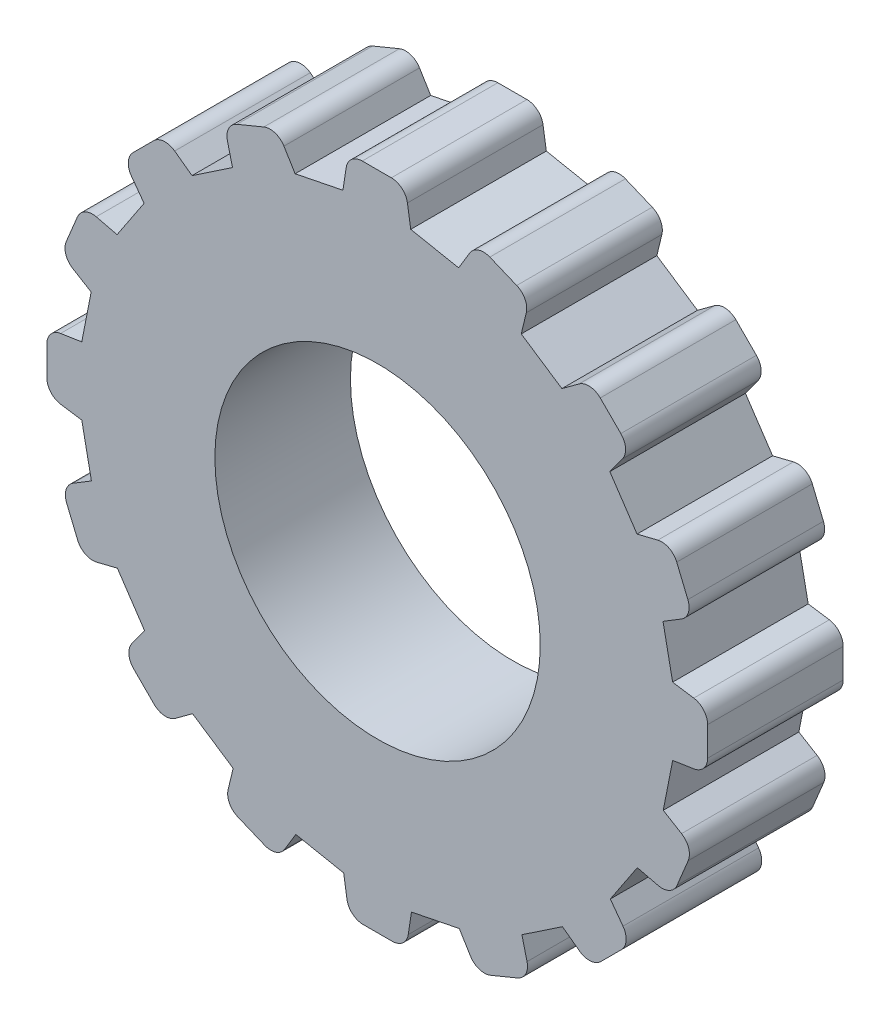
from build123d import *

# Parameters (mm, degrees)
ESQUISSE5_R        = 6
BOSS_EXTRU_1_DEPTH = 5


with BuildPart() as part:
    # Esquisse5 → Boss.-Extru.1 (new body)
    with BuildSketch(Plane.XY):
        with BuildLine():
            Line((0, 12.187189413), (0.508919212, 12.187189413))
            ThreePointArc((0.508919212, 12.187189413), (0.899044051, 12.043043128), (1.101718736, 11.679864778))
            Line((1.101718736, 11.679864778), (1.223875428, 10.898487461))
            Line((1.223875428, 10.898487461), (2.990113971, 10.551498398))
            Line((2.990113971, 10.551498398), (3.397524082, 11.2264814))
            ThreePointArc((3.397524082, 11.2264814), (3.723877023, 11.486437733), (4.140815501, 11.470758379))
            Line((4.140815501, 11.470758379), (4.661933908, 11.254904067))
            Line((4.661933908, 11.254904067), (5.132113951, 11.060149116))
            ThreePointArc((5.132113951, 11.060149116), (5.43737991, 10.777681002), (5.485644567, 10.364587714))
            Line((5.485644567, 10.364587714), (5.29948248, 9.595941861))
            Line((5.29948248, 9.595941861), (6.798487154, 8.59945554))
            Line((6.798487154, 8.59945554), (7.433189829, 9.06714942))
            ThreePointArc((7.433189829, 9.06714942), (7.834181612, 9.182427892), (8.21338231, 9.00838661))
            Line((8.21338231, 9.00838661), (8.612229071, 8.609539849))
            Line((8.612229071, 8.609539849), (8.972089297, 8.249679623))
            ThreePointArc((8.972089297, 8.249679623), (9.146022401, 7.871892888), (9.032529172, 7.47177437))
            Line((9.032529172, 7.47177437), (8.566389797, 6.832879345))
            Line((8.566389797, 6.832879345), (9.569950728, 5.338601775))
            Line((9.569950728, 5.338601775), (10.335318239, 5.52780438))
            ThreePointArc((10.335318239, 5.52780438), (10.749901501, 5.480854889), (11.033634549, 5.174947886))
            Line((11.033634549, 5.174947886), (11.249488861, 4.653829479))
            Line((11.249488861, 4.653829479), (11.444243812, 4.183649436))
            ThreePointArc((11.444243812, 4.183649436), (11.460364322, 3.768058687), (11.202391523, 3.441829356))
            Line((11.202391523, 3.441829356), (10.527240354, 3.029951135))
            Line((10.527240354, 3.029951135), (10.882574489, 1.26537253))
            Line((10.882574489, 1.26537253), (11.662086569, 1.147279478))
            ThreePointArc((11.662086569, 1.147279478), (12.027144767, 0.945249658), (12.172214381, 0.554048503))
            Line((12.172214381, 0.554048503), (12.172214381, -0.010005996))
            Line((12.172214381, -0.010005996), (12.172214381, -0.518925208))
            ThreePointArc((12.172214381, -0.518925208), (12.028068096, -0.909050047), (11.664889747, -1.111724733))
            Line((11.664889747, -1.111724733), (10.88351243, -1.233881424))
            Line((10.88351243, -1.233881424), (10.536523367, -3.000119967))
            Line((10.536523367, -3.000119967), (11.211506369, -3.407530078))
            ThreePointArc((11.211506369, -3.407530078), (11.471462701, -3.733883019), (11.455783348, -4.150821497))
            Line((11.455783348, -4.150821497), (11.239929036, -4.671939904))
            Line((11.239929036, -4.671939904), (11.045174085, -5.142119947))
            ThreePointArc((11.045174085, -5.142119947), (10.76270597, -5.447385906), (10.349612682, -5.495650563))
            Line((10.349612682, -5.495650563), (9.580966829, -5.309488476))
            Line((9.580966829, -5.309488476), (8.584480508, -6.80849315))
            Line((8.584480508, -6.80849315), (9.052174389, -7.443195825))
            ThreePointArc((9.052174389, -7.443195825), (9.167452861, -7.844187609), (8.993411579, -8.223388306))
            Line((8.993411579, -8.223388306), (8.594564817, -8.622235067))
            Line((8.594564817, -8.622235067), (8.234704592, -8.982095293))
            ThreePointArc((8.234704592, -8.982095293), (7.856917857, -9.156028397), (7.456799339, -9.042535168))
            Line((7.456799339, -9.042535168), (6.817904314, -8.576395793))
            Line((6.817904314, -8.576395793), (5.323626744, -9.579956724))
            Line((5.323626744, -9.579956724), (5.512829349, -10.345324235))
            ThreePointArc((5.512829349, -10.345324235), (5.465879858, -10.759907497), (5.159972855, -11.043640545))
            Line((5.159972855, -11.043640545), (4.638854448, -11.259494857))
            Line((4.638854448, -11.259494857), (4.168674404, -11.454249808))
            ThreePointArc((4.168674404, -11.454249808), (3.753083655, -11.470370318), (3.426854324, -11.212397519))
            Line((3.426854324, -11.212397519), (3.014976103, -10.53724635))
            Line((3.014976103, -10.53724635), (1.250397498, -10.892580485))
            Line((1.250397498, -10.892580485), (1.132304447, -11.672092565))
            ThreePointArc((1.132304447, -11.672092565), (0.930274627, -12.037150763), (0.539073472, -12.182220377))
            Line((0.539073472, -12.182220377), (-0.024981027, -12.182220377))
            Line((-0.024981027, -12.182220377), (-0.533900239, -12.182220377))
            ThreePointArc((-0.533900239, -12.182220377), (-0.924025078, -12.038074093), (-1.126699764, -11.674895743))
            Line((-1.126699764, -11.674895743), (-1.248856456, -10.893518426))
            Line((-1.248856456, -10.893518426), (-3.015094998, -10.546529363))
            Line((-3.015094998, -10.546529363), (-3.42250511, -11.221512365))
            ThreePointArc((-3.42250511, -11.221512365), (-3.74885805, -11.481468697), (-4.165796528, -11.465789344))
            Line((-4.165796528, -11.465789344), (-4.686914935, -11.249935032))
            Line((-4.686914935, -11.249935032), (-5.157094979, -11.055180081))
            ThreePointArc((-5.157094979, -11.055180081), (-5.462360938, -10.772711966), (-5.510625594, -10.359618678))
            Line((-5.510625594, -10.359618678), (-5.324463507, -9.590972826))
            Line((-5.324463507, -9.590972826), (-6.823468181, -8.594486504))
            Line((-6.823468181, -8.594486504), (-7.458170856, -9.062180385))
            ThreePointArc((-7.458170856, -9.062180385), (-7.85916264, -9.177458857), (-8.238363337, -9.003417575))
            Line((-8.238363337, -9.003417575), (-8.637210099, -8.604570813))
            Line((-8.637210099, -8.604570813), (-8.997070324, -8.244710588))
            ThreePointArc((-8.997070324, -8.244710588), (-9.171003428, -7.866923853), (-9.057510199, -7.466805335))
            Line((-9.057510199, -7.466805335), (-8.591370824, -6.82791031))
            Line((-8.591370824, -6.82791031), (-9.594931756, -5.33363274))
            Line((-9.594931756, -5.33363274), (-10.360299266, -5.522835345))
            ThreePointArc((-10.360299266, -5.522835345), (-10.774882529, -5.475885854), (-11.058615577, -5.169978851))
            Line((-11.058615577, -5.169978851), (-11.274469888, -4.648860444))
            Line((-11.274469888, -4.648860444), (-11.469224839, -4.178680401))
            ThreePointArc((-11.469224839, -4.178680401), (-11.48534535, -3.763089651), (-11.22737255, -3.43686032))
            Line((-11.22737255, -3.43686032), (-10.552221381, -3.024982099))
            Line((-10.552221381, -3.024982099), (-10.907555516, -1.260403495))
            Line((-10.907555516, -1.260403495), (-11.687067596, -1.142310443))
            ThreePointArc((-11.687067596, -1.142310443), (-12.052125795, -0.940280623), (-12.197195409, -0.549079468))
            Line((-12.197195409, -0.549079468), (-12.197195409, 0.014975031))
            Line((-12.197195409, 0.014975031), (-12.197195409, 0.523894243))
            ThreePointArc((-12.197195409, 0.523894243), (-12.053049124, 0.914019082), (-11.689870774, 1.116693768))
            Line((-11.689870774, 1.116693768), (-10.908493457, 1.238850459))
            Line((-10.908493457, 1.238850459), (-10.561504394, 3.005089002))
            Line((-10.561504394, 3.005089002), (-11.236487396, 3.412499114))
            ThreePointArc((-11.236487396, 3.412499114), (-11.496443729, 3.738852054), (-11.480764375, 4.155790532))
            Line((-11.480764375, 4.155790532), (-11.264910063, 4.676908939))
            Line((-11.264910063, 4.676908939), (-11.070155112, 5.147088983))
            ThreePointArc((-11.070155112, 5.147088983), (-10.787686998, 5.452354942), (-10.37459371, 5.500619598))
            Line((-10.37459371, 5.500619598), (-9.605947857, 5.314457511))
            Line((-9.605947857, 5.314457511), (-8.609461536, 6.813462185))
            Line((-8.609461536, 6.813462185), (-9.077155416, 7.44816486))
            ThreePointArc((-9.077155416, 7.44816486), (-9.192433888, 7.849156644), (-9.018392606, 8.228357341))
            Line((-9.018392606, 8.228357341), (-8.619545845, 8.627204103))
            Line((-8.619545845, 8.627204103), (-8.259685619, 8.987064328))
            ThreePointArc((-8.259685619, 8.987064328), (-7.881898884, 9.160997432), (-7.481780366, 9.047504203))
            Line((-7.481780366, 9.047504203), (-6.842885341, 8.581364828))
            Line((-6.842885341, 8.581364828), (-5.348607771, 9.58492576))
            Line((-5.348607771, 9.58492576), (-5.537810376, 10.35029327))
            ThreePointArc((-5.537810376, 10.35029327), (-5.490860885, 10.764876533), (-5.184953883, 11.04860958))
            Line((-5.184953883, 11.04860958), (-4.663835475, 11.264463892))
            Line((-4.663835475, 11.264463892), (-4.193655432, 11.459218843))
            ThreePointArc((-4.193655432, 11.459218843), (-3.778064683, 11.475339354), (-3.451835352, 11.217366554))
            Line((-3.451835352, 11.217366554), (-3.039957131, 10.542215385))
            Line((-3.039957131, 10.542215385), (-1.275378526, 10.89754952))
            Line((-1.275378526, 10.89754952), (-1.157285475, 11.6770616))
            ThreePointArc((-1.157285475, 11.6770616), (-0.955255654, 12.042119799), (-0.564054499, 12.187189413))
            Line((-0.564054499, 12.187189413), (0, 12.187189413))
        make_face()
        Circle(ESQUISSE5_R, mode=Mode.SUBTRACT)
    extrude(amount=BOSS_EXTRU_1_DEPTH)


solid = part.part
